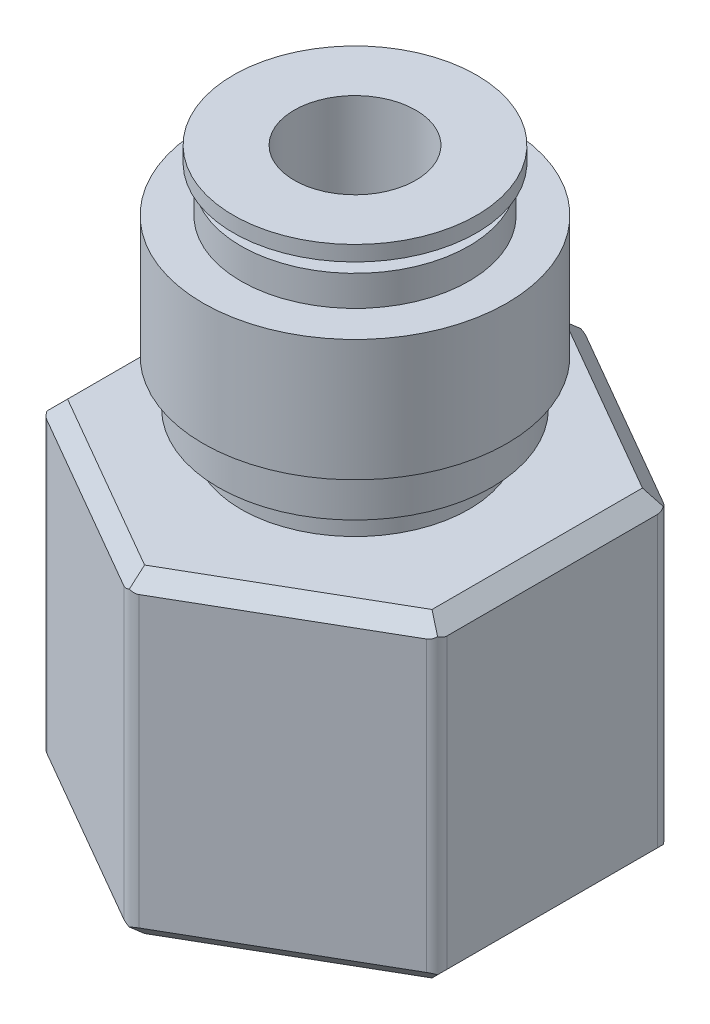
from build123d import *

# Parameters (mm, degrees)
EXTRUDE_1_DEPTH          = 21
SKETCH_2_R               = 7.5
EXTRUDE_2_DEPTH          = 2
SKETCH_3_R               = 9
EXTRUDE_3_DEPTH          = 3
SKETCH_4_R               = 10
EXTRUDE_4_DEPTH          = 8
SKETCH_5_R               = 7.5
EXTRUDE_5_DEPTH          = 2
CUT_EXTRUDE_1_DEPTH      = 42.106568818
CUT_EXTRUDE_1_DEPTH_BACK = 42.106568818
SKETCH_7_R               = 4
HOLE_WIZARD_G1_21_D      = 19
HOLE_WIZARD_G1_21_DEPTH  = 18
HOLE_WIZARD_G1_21_TIP    = 5.708175881
CHAMFER_1_SIZE           = 1
FILLET_1_R               = 1


with BuildPart() as part:
    # Эскиз1 → Бобышка-Вытянуть1 (new body)
    with BuildSketch(Plane(origin=(0, 0, 0), x_dir=(1, 0, 0), z_dir=(0, 1, 0))):
        Polygon((0, 15), (-12.990381057, 7.5), (-12.990381057, -7.5), (0, -15), (12.990381057, -7.5), (12.990381057, 7.5), align=None)
    extrude(amount=EXTRUDE_1_DEPTH)

    # Эскиз2 → Бобышка-Вытянуть2 (add)
    with BuildSketch(Plane(origin=(0, 21, 0), x_dir=(1, 0, 0), z_dir=(0, 1, 0))):
        with Locations(Location((0, 0, 0), (0, 0, 270))):
            Circle(SKETCH_2_R)
    extrude(amount=EXTRUDE_2_DEPTH)

    # Эскиз3 → Бобышка-Вытянуть3 (add)
    with BuildSketch(Plane(origin=(0, 23, 0), x_dir=(1, 0, 0), z_dir=(0, 1, 0))):
        with Locations(Location((0, 0, 0), (0, 0, 270))):
            Circle(SKETCH_3_R)
    extrude(amount=EXTRUDE_3_DEPTH)

    # Эскиз4 → Бобышка-Вытянуть4 (add)
    with BuildSketch(Plane(origin=(0, 26, 0), x_dir=(1, 0, 0), z_dir=(0, 1, 0))):
        with Locations(Location((0, 0, 0), (0, 0, 270))):
            Circle(SKETCH_4_R)
    extrude(amount=EXTRUDE_4_DEPTH)

    # Эскиз5 → Бобышка-Вытянуть5 (add)
    with BuildSketch(Plane(origin=(0, 34, 0), x_dir=(1, 0, 0), z_dir=(0, 1, 0))):
        with Locations(Location((0, 0, 0), (0, 0, 270))):
            Circle(SKETCH_5_R)
    extrude(amount=EXTRUDE_5_DEPTH)

    # Эскиз6 → Повернуть1 (revolve)
    with BuildSketch(Plane.XY, mode=Mode.PRIVATE) as revolve_1_sk:
        Polygon((-8, 37), (-6, 37), (-6, 36), (-4, 36), (-4, 38), (-8, 38), align=None)
    revolve(revolve_1_sk.sketch.rotate(Axis((0, 36, 0), (0, 1, 0)), 270), axis=Axis((0, 36, 0), (0, 1, 0)))

    # Эскиз7 → Вырез-Вытянуть1 (cut, two sides: drawn at the far end of the back side and taken through both)
    with BuildSketch(Plane(origin=(0, 36, 0), x_dir=(1, 0, 0), z_dir=(0, 1, 0)).offset(-CUT_EXTRUDE_1_DEPTH_BACK)):
        with Locations(Location((0, 0, 0), (0, 0, 90))):
            Circle(SKETCH_7_R)
    extrude(amount=CUT_EXTRUDE_1_DEPTH + CUT_EXTRUDE_1_DEPTH_BACK, mode=Mode.SUBTRACT)

    # Отверстие обработанное метчиком G1/21
    with Locations(Plane(origin=(0, 0, 0), x_dir=(-1, 0, 0), z_dir=(0, -1, 0))):
        with Locations((0, 0)):
            Hole(HOLE_WIZARD_G1_21_D / 2, depth=HOLE_WIZARD_G1_21_DEPTH)
            with Locations((0, 0, -(HOLE_WIZARD_G1_21_DEPTH + HOLE_WIZARD_G1_21_TIP / 2))):  # 118° drill point
                Cone(0, HOLE_WIZARD_G1_21_D / 2, HOLE_WIZARD_G1_21_TIP, mode=Mode.SUBTRACT)

    # Фаска1
    chamfer_1_edges = [part.edges().sort_by_distance(p)[0] for p in [
        (-12.990381057, 21, 0),
        (-6.495190528, 21, 11.25),
        (6.495190528, 21, 11.25),
        (12.990381057, 21, 0),
        (6.495190528, 21, -11.25),
        (-9.5, 0, 0),
        (12.990381057, 0, 0),
        (6.495190528, 0, 11.25),
        (-6.495190528, 0, 11.25),
        (-6.495190528, 21, -11.25),
        (-12.990381057, 0, 0),
        (-6.495190528, 0, -11.25),
        (6.495190528, 0, -11.25),
    ]]
    chamfer(chamfer_1_edges, length=CHAMFER_1_SIZE)

    # Скругление1
    fillet_1_edges = [part.edges().sort_by_distance(p)[0] for p in [
        (12.990381057, 10.5, -7.5),
        (12.990381057, 10.5, 7.5),
        (0, 10.5, 15),
        (-12.990381057, 10.5, 7.5),
        (-12.990381057, 10.5, -7.5),
        (0, 10.5, -15),
    ]]
    fillet(fillet_1_edges, radius=FILLET_1_R)


solid = part.part
